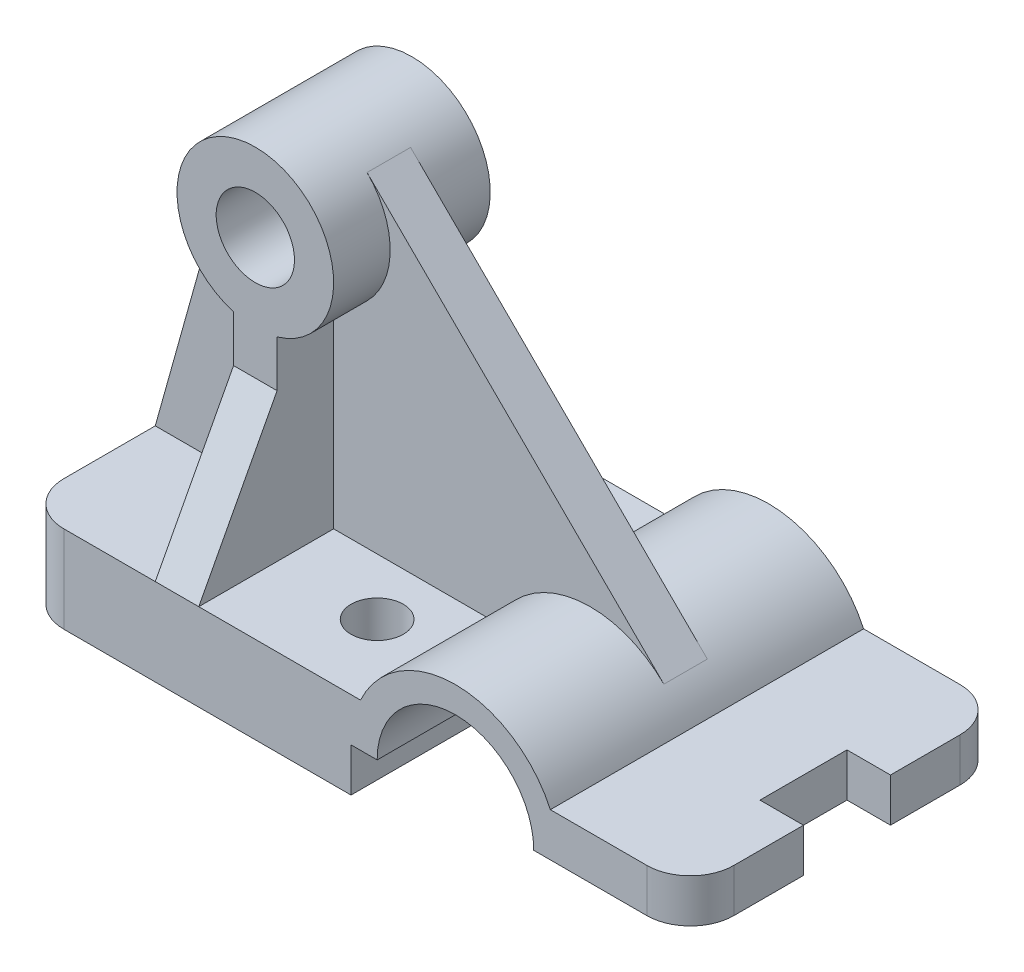
from build123d import *

# Parameters (mm, degrees)
BOSS_EXTRUDE1_DEPTH = 72
FILLET1_R           = 10
SKETCH2_W           = 10
SKETCH2_H           = 20
CUT_EXTRUDE1_DEPTH  = 72
SKETCH3_R           = 18
SKETCH3_R_2         = 9
BOSS_EXTRUDE2_DEPTH = 18
BOSS_EXTRUDE4_DEPTH = 5
RIB20_REACH         = 189.115
SKETCH6_WALL_W      = 472.375598612
SKETCH6_WALL_H      = 10
RIB21_REACH         = 189.115
SKETCH7_WALL_W      = 445.62728217
SKETCH7_WALL_H      = 10
SKETCH8_R           = 6
CUT_EXTRUDE2_DEPTH  = 100


with BuildPart() as part:
    # Sketch1 → Boss-Extrude1 (new body)
    with BuildSketch(Plane.XY):
        with BuildLine():
            Line((76, 0), (76, 10))
            Line((76, 10), (82, 10))
            ThreePointArc((82, 10), (100, 28), (118, 10))
            Line((118, 10), (154, 10))
            Line((154, 10), (154, 20))
            Line((154, 20), (121.817424229, 20))
            ThreePointArc((121.817424229, 20), (100, 34), (78.182575771, 20))
            Line((78.182575771, 20), (0, 20))
            Line((0, 20), (0, 0))
            Line((0, 0), (76, 0))
        make_face()
    extrude(amount=BOSS_EXTRUDE1_DEPTH)

    # Fillet1
    fillet1_edges = [part.edges().sort_by_distance(p)[0] for p in [
        (154, 15, 0),
        (0, 10, 0),
        (154, 15, 72),
        (0, 10, 72),
    ]]
    fillet(fillet1_edges, radius=FILLET1_R)

    # Sketch2 → Cut-Extrude1 (cut)
    with BuildSketch(Plane(origin=(0, 20, 0), x_dir=(1, 0, 0), z_dir=(0, 1, 0))):
        with Locations((149, -36)):
            Rectangle(SKETCH2_W, SKETCH2_H)
    extrude(amount=-CUT_EXTRUDE1_DEPTH, mode=Mode.SUBTRACT)



with BuildPart() as body_2:
    # Sketch3 → Boss-Extrude2 (new, symmetric)
    with BuildSketch(Plane.XY.offset(36)):
        with Locations((36, 82)):
            Circle(SKETCH3_R)
        with Locations((36, 82)):
            Circle(SKETCH3_R_2, mode=Mode.SUBTRACT)
    extrude(amount=BOSS_EXTRUDE2_DEPTH, both=True)


with BuildPart() as part_1:
    add(part.part)

    add(body_2.part)  # Boss-Extrude4 merges body 2
    # Sketch4 → Boss-Extrude4 (add, symmetric)
    with BuildSketch(Plane(origin=(36, 0, 0), x_dir=(0, 0, -1), z_dir=(1, 0, 0))):
        Polygon((-54, 54), (-54, 70.710811109), (-18, 70.710811109), (-18, 54), (0, 20), (-72, 20), align=None)
    extrude(amount=BOSS_EXTRUDE4_DEPTH, both=True)

    # Sketch6 wall → Rib20 (add, up to next)
    with BuildSketch(Plane(origin=(82.796156549, 60.902139154, 36), x_dir=(0.709625674032, -0.704578883273, 0), z_dir=(0.704578883273, 0.709625674032, 0)), mode=Mode.PRIVATE) as rib20_sk1:
        Rectangle(SKETCH6_WALL_W, SKETCH6_WALL_H)
    rib20_tool1 = extrude(rib20_sk1.sketch, amount=-RIB20_REACH, mode=Mode.PRIVATE) - part_1.part
    add(rib20_tool1.solids().sort_by_distance((82.796156549, 60.902139154, 36))[0])

    # Sketch7 wall → Rib21 (add, up to next)
    with BuildSketch(Plane(origin=(9.33156562, 53.420381253, 36), x_dir=(0.268931250293, 0.963159375501, 0), z_dir=(-0.963159375501, 0.268931250293, 0)), mode=Mode.PRIVATE) as rib21_sk1:
        Rectangle(SKETCH7_WALL_W, SKETCH7_WALL_H)
    rib21_tool1 = extrude(rib21_sk1.sketch, amount=-RIB21_REACH, mode=Mode.PRIVATE) - part_1.part
    add(rib21_tool1.solids().sort_by_distance((9.33156562, 53.420381253, 36))[0])

    # Sketch8 → Cut-Extrude2 (cut)
    with BuildSketch(Plane(origin=(0, 0, 0), x_dir=(1, 0, 0), z_dir=(0, 1, 0))):
        with Locations((64, -18)):
            Circle(SKETCH8_R)
        with Locations((64, -54)):
            Circle(SKETCH8_R)
    extrude(amount=CUT_EXTRUDE2_DEPTH, mode=Mode.SUBTRACT)


solid = part_1.part
